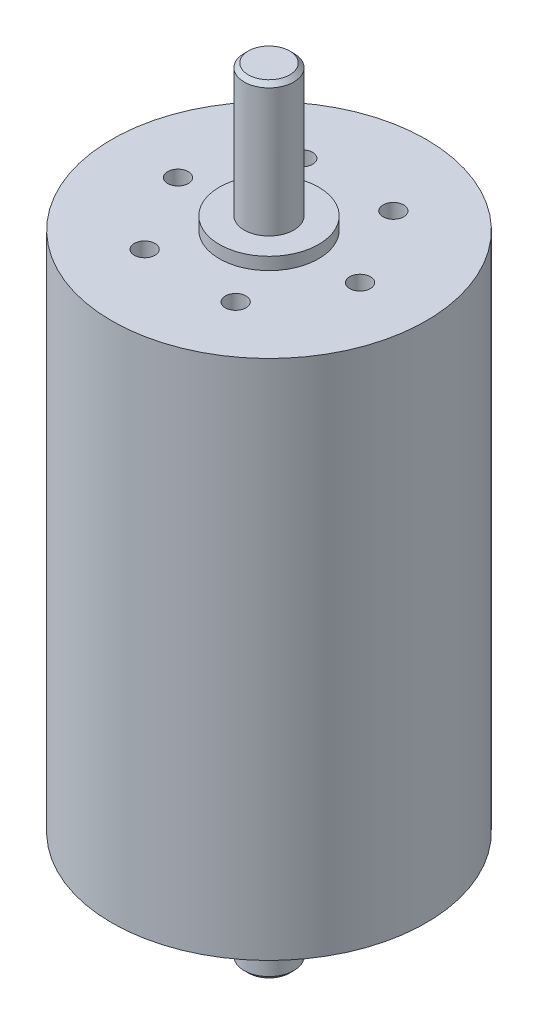
from build123d import *

# Parameters (mm, degrees)
ESQUISSE2_R             = 1.25
ENL_V_MAT_EXTRU_1_DEPTH = 3
ENL_V_START             = -60
ESQUISSE2_2_R           = 1.25
ENL_V_MAT_EXTRU_2_DEPTH = 3
CHANFREIN1_SIZE         = 0.5


with BuildPart() as part:
    # Esquisse1 → Révolution1 (revolve)
    with BuildSketch(Plane.XY, mode=Mode.PRIVATE) as r_volution1_sk:
        Polygon((0, 0), (0, 94), (3, 94), (3, 78), (6, 78), (6, 76.5), (19, 76.5), (19, 13.5), (6, 13.5), (6, 12), (3, 12), (3, 0), align=None)
    revolve(r_volution1_sk.sketch.rotate(Axis((0, 0, 0), (0, 1, 0)), 90), axis=Axis((0, 0, 0), (0, 1, 0)))

    # Esquisse2 → Enlèv. mat.-Extru.1 (cut)
    with BuildSketch(Plane.XZ.offset(-13.5)):
        with Locations(Location((11, 0, 0), (0, 0, 270))):
            Circle(ESQUISSE2_R)
        with Locations(Location((5.5, -9.526279442, 0), (0, 0, 270))):
            Circle(ESQUISSE2_R)
        with Locations(Location((-5.5, -9.526279442, 0), (0, 0, 270))):
            Circle(ESQUISSE2_R)
        with Locations(Location((-11, 0, 0), (0, 0, 270))):
            Circle(ESQUISSE2_R)
        with Locations(Location((-5.5, 9.526279442, 0), (0, 0, 270))):
            Circle(ESQUISSE2_R)
        with Locations(Location((5.5, 9.526279442, 0), (0, 0, 270))):
            Circle(ESQUISSE2_R)
    extrude(amount=-ENL_V_MAT_EXTRU_1_DEPTH, mode=Mode.SUBTRACT)

    # Esquisse2<2> → Enlèv. mat.-Extru.2 (cut)
    with BuildSketch(Plane.XZ.offset(-13.5).offset(ENL_V_START)):
        with Locations(Location((11, 0, 0), (0, 0, 270))):
            Circle(ESQUISSE2_2_R)
        with Locations(Location((5.5, -9.526279442, 0), (0, 0, 270))):
            Circle(ESQUISSE2_2_R)
        with Locations(Location((-5.5, -9.526279442, 0), (0, 0, 270))):
            Circle(ESQUISSE2_2_R)
        with Locations(Location((-11, 0, 0), (0, 0, 270))):
            Circle(ESQUISSE2_2_R)
        with Locations(Location((-5.5, 9.526279442, 0), (0, 0, 270))):
            Circle(ESQUISSE2_2_R)
        with Locations(Location((5.5, 9.526279442, 0), (0, 0, 270))):
            Circle(ESQUISSE2_2_R)
    extrude(amount=-ENL_V_MAT_EXTRU_2_DEPTH, mode=Mode.SUBTRACT)

    # Chanfrein1
    chanfrein1_edges = [part.edges().sort_by_distance(p)[0] for p in [
        (0, 94, 3),
        (0, 0, 3),
    ]]
    chamfer(chanfrein1_edges, length=CHANFREIN1_SIZE)


solid = part.part
